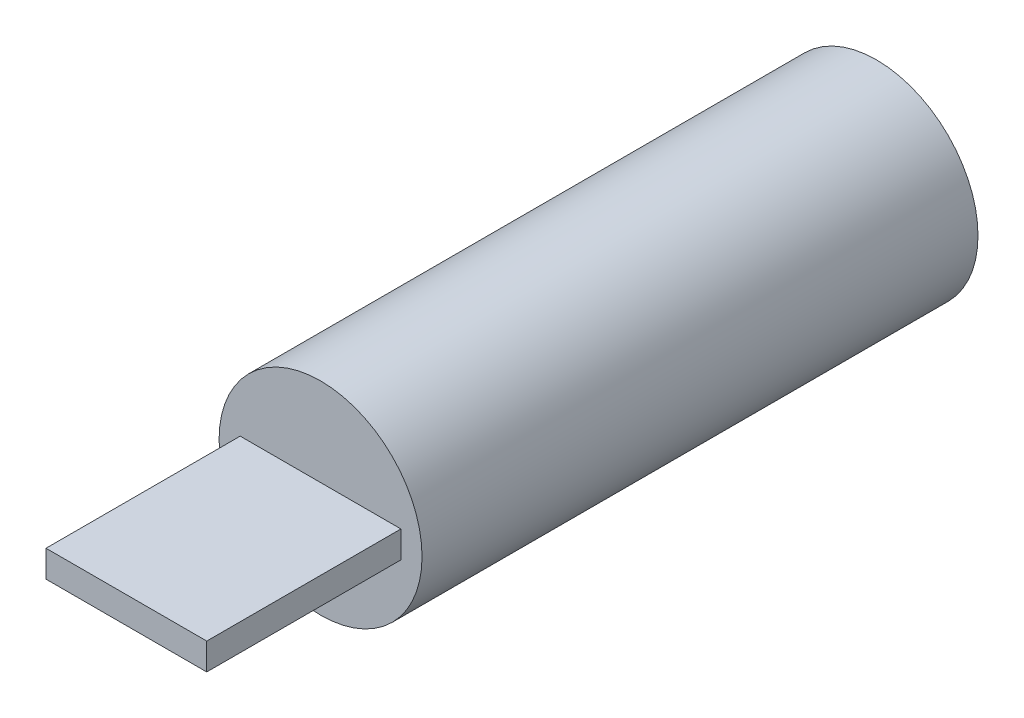
from build123d import *

# Parameters (mm, degrees)
SKETCH1_R           = 12.0269
BOSS_EXTRUDE1_DEPTH = 65.8876
SKETCH2_W           = 19.05
SKETCH2_H           = 3.175
BOSS_EXTRUDE2_DEPTH = 23.0124


with BuildPart() as part:
    # Sketch1 → Boss-Extrude1 (new body)
    with BuildSketch(Plane.XY):
        Circle(SKETCH1_R)
    extrude(amount=BOSS_EXTRUDE1_DEPTH)

    # Sketch2 → Boss-Extrude2 (add)
    with BuildSketch(Plane.XY.offset(65.8876)):
        Rectangle(SKETCH2_W, SKETCH2_H)
    extrude(amount=BOSS_EXTRUDE2_DEPTH)


solid = part.part
